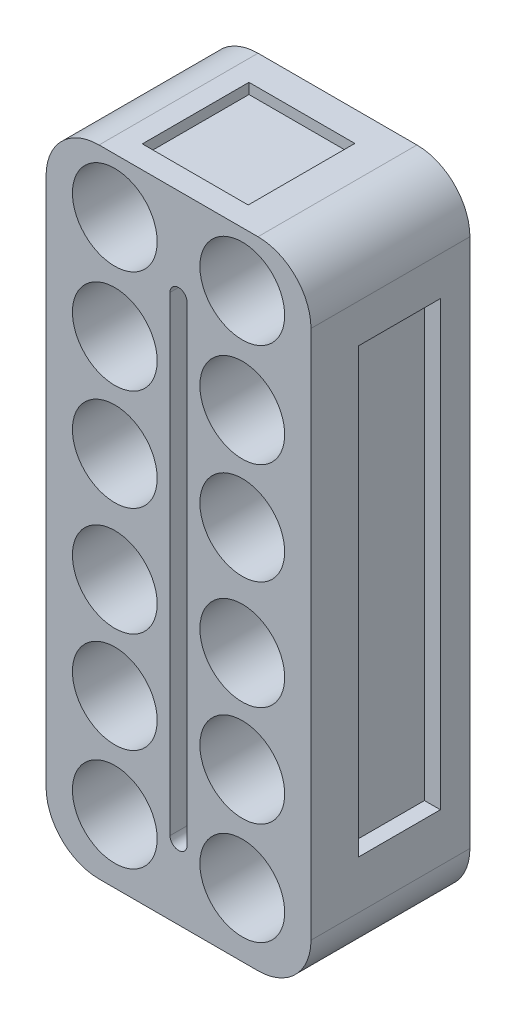
from build123d import *

# Parameters (mm, degrees)
BOSS_EXTRUDE4_DEPTH = 15
BOSS_EXTRUDE5_DEPTH = 15
SKETCH3_R           = 8
CUT_EXTRUDE2_DEPTH  = 15
CUT_EXTRUDE3_DEPTH  = 5
SKETCH5_W           = 23.42124253
SKETCH5_H           = 18.287225632
CUT_EXTRUDE5_DEPTH  = 3
SKETCH6_W           = 19.984458363
SKETCH6_H           = 20.131216134
CUT_EXTRUDE7_DEPTH  = 2
SKETCH7_W           = 16.913194531
SKETCH7_H           = 80.268822813
CUT_EXTRUDE8_DEPTH  = 3
SKETCH8_W           = 15.481131963
SKETCH8_H           = 83.563031186
CUT_EXTRUDE9_DEPTH  = 3


with BuildPart() as part:
    # Sketch1 → Boss-Extrude4 (new body)
    with BuildSketch(Plane.XY):
        with BuildLine():
            Line((-15, 120), (15, 120))
            ThreePointArc((15, 120), (22.071067812, 117.071067812), (25, 110))
            Line((25, 110), (25, 10))
            ThreePointArc((25, 10), (22.071067812, 2.928932188), (15, 0))
            Line((15, 0), (-15, 0))
            ThreePointArc((-15, 0), (-22.071067812, 2.928932188), (-25, 10))
            Line((-25, 10), (-25, 110))
            ThreePointArc((-25, 110), (-22.071067812, 117.071067812), (-15, 120))
        make_face()
    extrude(amount=BOSS_EXTRUDE4_DEPTH)

    # Sketch2 → Boss-Extrude5 (add)
    with BuildSketch(Plane.XY.offset(15)):
        with BuildLine():
            Line((15, 120), (0, 120))
            Line((0, 120), (0, 0))
            Line((0, 0), (15, 0))
            ThreePointArc((15, 0), (22.071067812, 2.928932188), (25, 10))
            Line((25, 10), (25, 110))
            ThreePointArc((25, 110), (22.071067812, 117.071067812), (15, 120))
        make_face()
        with BuildLine():
            Line((0, 0), (0, 120))
            Line((0, 120), (-15, 120))
            ThreePointArc((-15, 120), (-22.071067812, 117.071067812), (-25, 110))
            Line((-25, 110), (-25, 10))
            ThreePointArc((-25, 10), (-22.071067812, 2.928932188), (-15, 0))
            Line((-15, 0), (0, 0))
        make_face()
    extrude(amount=BOSS_EXTRUDE5_DEPTH)

    # Sketch3 → Cut-Extrude2 (cut)
    with BuildSketch(Plane.XY.offset(30)):
        with Locations((-12.033216968, 109.656218371)):
            Circle(SKETCH3_R)
        with Locations((-12.033216968, 90.176581151)):
            Circle(SKETCH3_R)
        with Locations((-12.033216968, 70.997837903)):
            Circle(SKETCH3_R)
        with Locations((-12.033216968, 50.457885697)):
            Circle(SKETCH3_R)
        with Locations((-12.033216968, 31.422403349)):
            Circle(SKETCH3_R)
        with Locations((-12.033216968, 12.050211805)):
            Circle(SKETCH3_R)
        with Locations(Location((12.033216968, 12.050211805, 0), (0, 0, 180))):
            Circle(SKETCH3_R)
        with Locations(Location((12.033216968, 31.422403349, 0), (0, 0, 180))):
            Circle(SKETCH3_R)
        with Locations(Location((12.033216968, 50.457885697, 0), (0, 0, 180))):
            Circle(SKETCH3_R)
        with Locations(Location((12.033216968, 70.997837903, 0), (0, 0, 180))):
            Circle(SKETCH3_R)
        with Locations(Location((12.033216968, 90.176581151, 0), (0, 0, 180))):
            Circle(SKETCH3_R)
        with Locations(Location((12.033216968, 109.656218371, 0), (0, 0, 180))):
            Circle(SKETCH3_R)
    extrude(amount=-CUT_EXTRUDE2_DEPTH, mode=Mode.SUBTRACT)

    # Sketch4 → Cut-Extrude3 (cut)
    with BuildSketch(Plane.XY.offset(30)):
        with BuildLine():
            Line((-1.612294676, 13.790891011), (-1.612294676, 102.589988378))
            ThreePointArc((-1.612294676, 102.589988378), (0, 104.202283053), (1.612294676, 102.589988378))
            Line((1.612294676, 102.589988378), (1.612294676, 13.790891011))
            ThreePointArc((1.612294676, 13.790891011), (0, 12.178596336), (-1.612294676, 13.790891011))
        make_face()
    extrude(amount=-CUT_EXTRUDE3_DEPTH, mode=Mode.SUBTRACT)

    # Sketch5 → Cut-Extrude5 (cut)
    with BuildSketch(Plane(origin=(0, 0, 0), x_dir=(-1, 0, 0), z_dir=(0, -1, 0))):
        with Locations((1.812031263, -14.475485378)):
            Rectangle(SKETCH5_W, SKETCH5_H)
    extrude(amount=-CUT_EXTRUDE5_DEPTH, mode=Mode.SUBTRACT)

    # Sketch6 → Cut-Extrude7 (cut)
    with BuildSketch(Plane(origin=(0, 120, 0), x_dir=(1, 0, 0), z_dir=(0, 1, 0))):
        with Locations((-1.103321986, -15.673777661)):
            Rectangle(SKETCH6_W, SKETCH6_H)
    extrude(amount=-CUT_EXTRUDE7_DEPTH, mode=Mode.SUBTRACT)

    # Sketch7 → Cut-Extrude8 (cut)
    with BuildSketch(Plane.ZY.offset(25)):
        with Locations((14.78025647, 58.832283621)):
            Rectangle(SKETCH7_W, SKETCH7_H)
    extrude(amount=-CUT_EXTRUDE8_DEPTH, mode=Mode.SUBTRACT)

    # Sketch8 → Cut-Extrude9 (cut)
    with BuildSketch(Plane(origin=(25, 0, 0), x_dir=(0, 0, -1), z_dir=(1, 0, 0))):
        with Locations((-13.31664767, 60.895190622)):
            Rectangle(SKETCH8_W, SKETCH8_H)
    extrude(amount=-CUT_EXTRUDE9_DEPTH, mode=Mode.SUBTRACT)


solid = part.part
